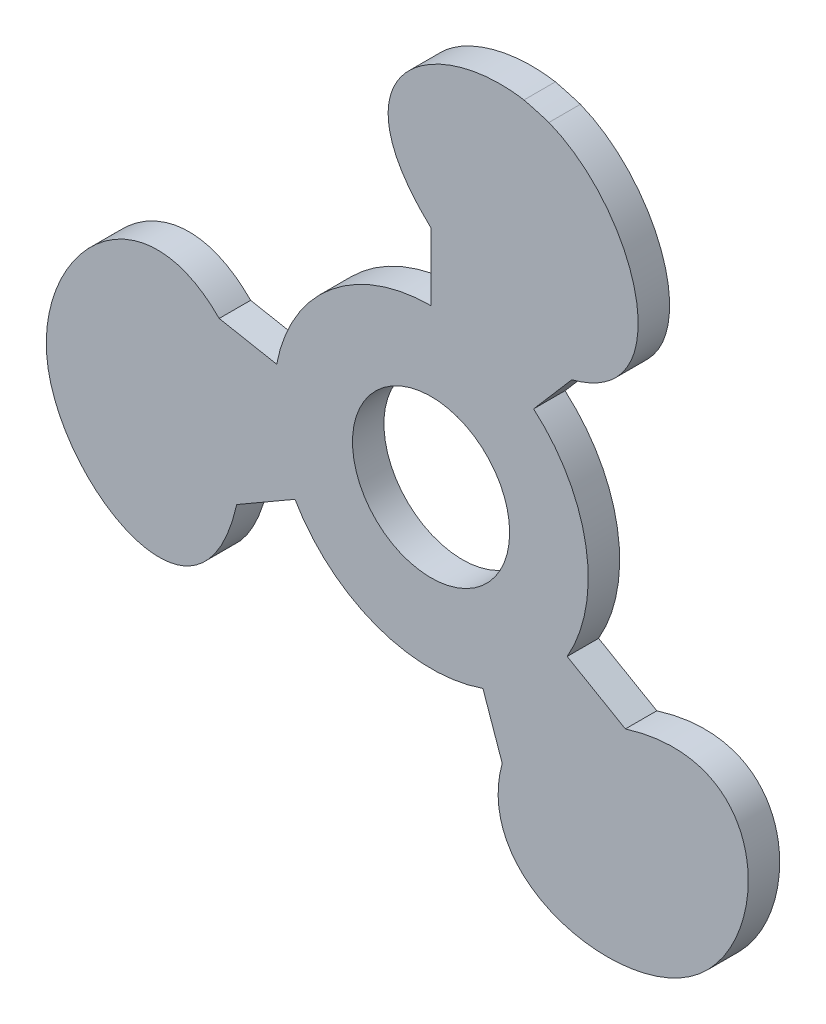
from build123d import *

# Parameters (mm, degrees)
EXTRUDE_1_DEPTH     = 2
SKETCH_2_R          = 10
EXTRUDE_2_DEPTH     = 2
SKETCH_3_R          = 5
CUT_EXTRUDE_1_DEPTH = 2


with BuildPart() as part:
    # 草图1 → 凸台-拉伸1 (new body)
    with BuildSketch(Plane.XY):
        with BuildLine():
            Line((0, 14.278189945), (0, 5))
            ThreePointArc((0, 5), (-3.189255031, 3.850798923), (-4.912471936, 0.931460939))
            Line((-4.912471936, 0.931460939), (-13.482158936, 2.556371739))
            add(Edge.make_bspline(
                [(-12.365275213, -7.139094973), (-14.554153712, -16.794034), (-32.129621236, -6.762889891), (-18.674887245, 7.806911129), (-13.482158936, 2.556371739)],
                knots=[0, 0, 0, 0, 0.508066186, 1, 1, 1, 1], degree=3))
            Line((-12.365275213, -7.139094973), (-4.330127019, -2.5))
            ThreePointArc((-4.330127019, -2.5), (-1.740262177, -4.687375338), (1.649567132, -4.720055961))
            Line((1.649567132, -4.720055961), (4.527196601, -12.954078006))
            add(Edge.make_bspline(
                [(12.365275213, -7.139094973), (21.821136933, -4.207249845), (21.921645067, -24.443623258), (2.57646026, -20.076382332), (4.527196601, -12.954078006)],
                knots=[0, 0, 0, 0, 0.508066186, 1, 1, 1, 1], degree=3))
            Line((12.365275213, -7.139094973), (4.330127019, -2.5))
            ThreePointArc((4.330127019, -2.5), (4.929517208, 0.836576414), (3.262904804, 3.788595022))
            Line((3.262904804, 3.788595022), (8.954962335, 10.397706267))
            add(Edge.make_bspline(
                [(7.499565038, 23.84861682), (13.200715048, 21.585242478), (16.098426985, 12.269471203), (8.954962335, 10.397706267)],
                knots=[0.508066186, 0.508066186, 0.508066186, 0.508066186, 1, 1, 1, 1], degree=3))
            ThreePointArc((7.499565038, 23.84861682), (6.708252817, 24.083175541), (5.909629214, 24.291485804))
            add(Edge.make_bspline(
                [(0, 14.278189945), (-6.635591744, 20.417148167), (0.190529491, 25.273619091), (5.909629214, 24.291485804)],
                knots=[0, 0, 0, 0, 0.46392288, 0.46392288, 0.46392288, 0.46392288], degree=3))
        make_face()
    extrude(amount=EXTRUDE_1_DEPTH)

    # 草图2 → 凸台-拉伸2 (add)
    with BuildSketch(Plane.XY.offset(2)):
        Circle(SKETCH_2_R)
    extrude(amount=-EXTRUDE_2_DEPTH)

    # 草图3 → 切除-拉伸1 (cut)
    with BuildSketch(Plane.XY.offset(2)):
        Circle(SKETCH_3_R)
    extrude(amount=-CUT_EXTRUDE_1_DEPTH, mode=Mode.SUBTRACT)


solid = part.part
